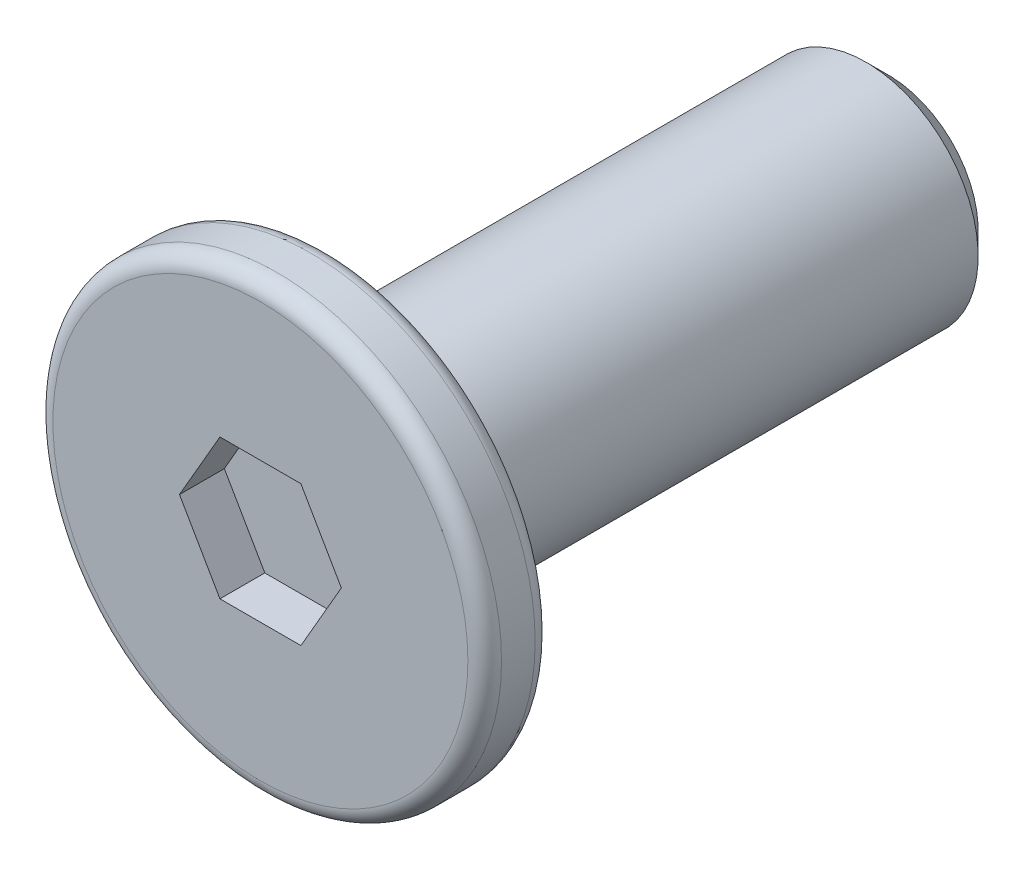
from build123d import *

# Parameters (mm, degrees)
SKETCH_1_R          = 4
EXTRUDE_1_DEPTH     = 0.6
SKETCH_2_R          = 2
EXTRUDE_2_DEPTH     = 10
CHAMFER_1_SIZE      = 0.4
CUT_EXTRUDE_1_DEPTH = 0.8
FILLET_2_R          = 0.3


with BuildPart() as part:
    # 草图1 → 凸台-拉伸1 (new, symmetric)
    with BuildSketch(Plane.XY):
        Circle(SKETCH_1_R)
    extrude(amount=EXTRUDE_1_DEPTH, both=True)

    # 草图2 → 凸台-拉伸2 (add)
    with BuildSketch(Plane(origin=(0, 0, -0.6), x_dir=(-1, 0, 0), z_dir=(0, 0, -1))):
        Circle(SKETCH_2_R)
    extrude(amount=EXTRUDE_2_DEPTH)

    # 倒角1
    chamfer_1_edges = [part.edges().sort_by_distance(p)[0] for p in [
        (2, 0, -10.6),
    ]]
    chamfer(chamfer_1_edges, length=CHAMFER_1_SIZE)

    # 草图3 → 切除-拉伸1 (cut)
    with BuildSketch(Plane.XY.offset(0.6)):
        Polygon((1.443375673, 0), (0.721687836, 1.25), (-0.721687836, 1.25), (-1.443375673, 0), (-0.721687836, -1.25), (0.721687836, -1.25), align=None)
    extrude(amount=-CUT_EXTRUDE_1_DEPTH, mode=Mode.SUBTRACT)

    # 圆角2
    fillet_2_edges = [part.edges().sort_by_distance(p)[0] for p in [
        (-4, 0, -0.6),
        (-4, 0, 0.6),
    ]]
    fillet(fillet_2_edges, radius=FILLET_2_R)


solid = part.part
